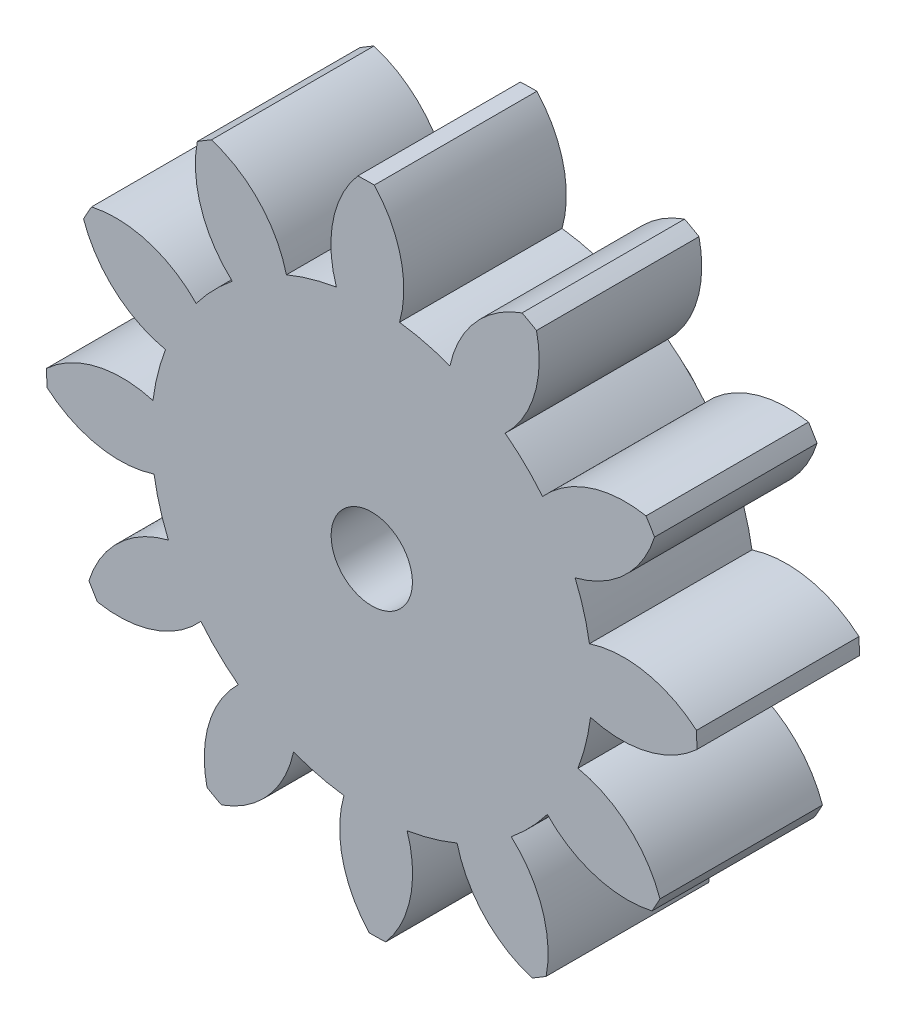
from build123d import *

# Parameters (mm, degrees)
BOSS_EXTRUDE1_DEPTH = 6
SKETCH3_R           = 1.5
CUT_EXTRUDE1_DEPTH  = 19.000399801
SKETCH4_R           = 2.5
SKETCH4_R_2         = 2.25
BOSS_EXTRUDE2_DEPTH = 4


with BuildPart() as part:
    # Sketch1 → Boss-Extrude1 (new body)
    with BuildSketch(Plane.XY):
        with BuildLine():
            ThreePointArc((-10.640037181, 5.549486938), (-9.475370008, 3.822122054), (-7.61385122, 2.886714725))
            ThreePointArc((-7.61385122, 2.886714725), (-7.90084423, 1.969901713), (-8.07786208, 1.025668813))
            ThreePointArc((-8.07786208, 1.025668813), (-10.160632754, 1.073683298), (-11.999921522, 0.095288749))
            ThreePointArc((-11.999921522, 0.095288749), (-11.998472146, -0.20943411), (-11.989285965, -0.514021924))
            ThreePointArc((-11.989285965, -0.514021924), (-10.116972164, -1.427630209), (-8.03714594, -1.306957324))
            ThreePointArc((-8.03714594, -1.306957324), (-7.827282671, -2.244437189), (-7.508468176, -3.150675792))
            ThreePointArc((-7.508468176, -3.150675792), (-9.336207732, -4.150479365), (-10.439881257, -5.917438283))
            ThreePointArc((-10.439881257, -5.917438283), (-10.28626463, -6.180611333), (-10.126015257, -6.439799027))
            ThreePointArc((-10.126015257, -6.439799027), (-8.047739799, -6.29485011), (-6.306893895, -5.150431214))
            ThreePointArc((-6.306893895, -5.150431214), (-5.656407041, -5.857380958), (-4.927186288, -6.482799363))
            ThreePointArc((-4.927186288, -6.482799363), (-6.010153389, -8.262524434), (-6.082483239, -10.344592507))
            ThreePointArc((-6.082483239, -10.344592507), (-5.817860813, -10.49569874), (-5.549486938, -10.640037181))
            ThreePointArc((-5.549486938, -10.640037181), (-3.822122054, -9.475370008), (-2.886714725, -7.61385122))
            ThreePointArc((-2.886714725, -7.61385122), (-1.969901713, -7.90084423), (-1.025668813, -8.07786208))
            ThreePointArc((-1.025668813, -8.07786208), (-1.073683298, -10.160632754), (-0.095288749, -11.999921522))
            ThreePointArc((-0.095288749, -11.999921522), (0.20943411, -11.998472146), (0.514021924, -11.989285965))
            ThreePointArc((0.514021924, -11.989285965), (1.427630209, -10.116972164), (1.306957324, -8.03714594))
            ThreePointArc((1.306957324, -8.03714594), (2.244437189, -7.827282671), (3.150675792, -7.508468176))
            ThreePointArc((3.150675792, -7.508468176), (4.150479365, -9.336207732), (5.917438283, -10.439881257))
            ThreePointArc((5.917438283, -10.439881257), (6.180611333, -10.28626463), (6.439799027, -10.126015257))
            ThreePointArc((6.439799027, -10.126015257), (6.29485011, -8.047739799), (5.150431214, -6.306893895))
            ThreePointArc((5.150431214, -6.306893895), (5.857380958, -5.656407041), (6.482799363, -4.927186288))
            ThreePointArc((6.482799363, -4.927186288), (8.262524434, -6.010153389), (10.344592507, -6.082483239))
            ThreePointArc((10.344592507, -6.082483239), (10.49569874, -5.817860813), (10.640037181, -5.549486938))
            ThreePointArc((10.640037181, -5.549486938), (9.475370008, -3.822122054), (7.61385122, -2.886714725))
            ThreePointArc((7.61385122, -2.886714725), (7.90084423, -1.969901713), (8.07786208, -1.025668813))
            ThreePointArc((8.07786208, -1.025668813), (10.160632754, -1.073683298), (11.999921522, -0.095288749))
            ThreePointArc((11.999921522, -0.095288749), (11.998472146, 0.20943411), (11.989285965, 0.514021924))
            ThreePointArc((11.989285965, 0.514021924), (10.116972164, 1.427630209), (8.03714594, 1.306957324))
            ThreePointArc((8.03714594, 1.306957324), (7.827282671, 2.244437189), (7.508468176, 3.150675792))
            ThreePointArc((7.508468176, 3.150675792), (9.336207732, 4.150479365), (10.439881257, 5.917438283))
            ThreePointArc((10.439881257, 5.917438283), (10.28626463, 6.180611333), (10.126015257, 6.439799027))
            ThreePointArc((10.126015257, 6.439799027), (8.047739799, 6.29485011), (6.306893895, 5.150431214))
            ThreePointArc((6.306893895, 5.150431214), (5.656407041, 5.857380958), (4.927186288, 6.482799363))
            ThreePointArc((4.927186288, 6.482799363), (6.010153389, 8.262524434), (6.082483239, 10.344592507))
            ThreePointArc((6.082483239, 10.344592507), (5.817860813, 10.49569874), (5.549486938, 10.640037181))
            ThreePointArc((5.549486938, 10.640037181), (3.822122054, 9.475370008), (2.886714725, 7.61385122))
            ThreePointArc((2.886714725, 7.61385122), (1.969901713, 7.90084423), (1.025668813, 8.07786208))
            ThreePointArc((1.025668813, 8.07786208), (1.073683298, 10.160632754), (0.095288749, 11.999921522))
            ThreePointArc((0.095288749, 11.999921522), (-0.20943411, 11.998472146), (-0.514021924, 11.989285965))
            ThreePointArc((-0.514021924, 11.989285965), (-1.427630209, 10.116972164), (-1.306957324, 8.03714594))
            ThreePointArc((-1.306957324, 8.03714594), (-2.244437189, 7.827282671), (-3.150675792, 7.508468176))
            ThreePointArc((-3.150675792, 7.508468176), (-4.150479365, 9.336207732), (-5.917438283, 10.439881257))
            ThreePointArc((-5.917438283, 10.439881257), (-6.180611333, 10.28626463), (-6.439799027, 10.126015257))
            ThreePointArc((-6.439799027, 10.126015257), (-6.29485011, 8.047739799), (-5.150431214, 6.306893895))
            ThreePointArc((-5.150431214, 6.306893895), (-5.857380958, 5.656407041), (-6.482799363, 4.927186288))
            ThreePointArc((-6.482799363, 4.927186288), (-8.262524434, 6.010153389), (-10.344592507, 6.082483239))
            ThreePointArc((-10.344592507, 6.082483239), (-10.49569874, 5.817860813), (-10.640037181, 5.549486938))
        make_face()
    extrude(amount=BOSS_EXTRUDE1_DEPTH)

    # Sketch3 → Cut-Extrude1 (cut, through all)
    with BuildSketch(Plane(origin=(0, 0, 0), x_dir=(-1, 0, 0), z_dir=(0, 0, -1))):
        Circle(SKETCH3_R)
    extrude(amount=-CUT_EXTRUDE1_DEPTH, mode=Mode.SUBTRACT)


with BuildPart() as body_2:
    # Sketch4 → Boss-Extrude2 (new body)
    with BuildSketch(Plane(origin=(0, 0, 0), x_dir=(-1, 0, 0), z_dir=(0, 0, -1))):
        Circle(SKETCH4_R)
        Circle(SKETCH4_R_2, mode=Mode.SUBTRACT)
    extrude(amount=BOSS_EXTRUDE2_DEPTH)


solid = Compound([part.part, body_2.part])
